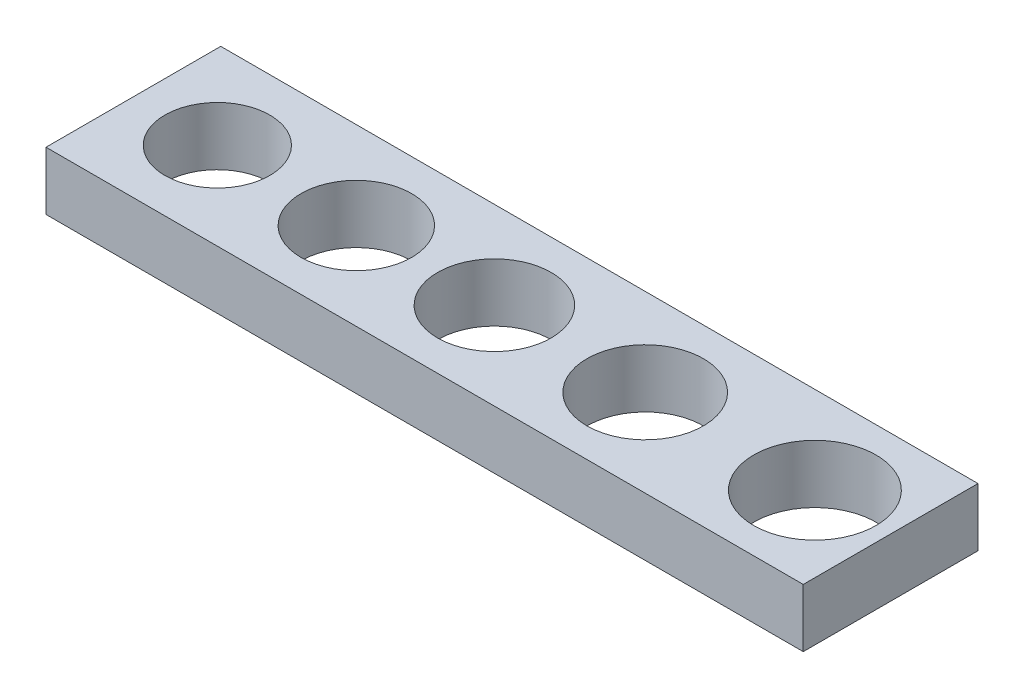
from build123d import *

# Parameters (mm, degrees)
SKETCH1_W           = 65
SKETCH1_H           = 15
BOSS_EXTRUDE1_DEPTH = 5
SKETCH2_R           = 4.75
SKETCH2_R_2         = 5
SKETCH2_R_3         = 5.25
SKETCH2_R_4         = 4.5
SKETCH2_R_5         = 4.875
CUT_EXTRUDE1_DEPTH  = 5


with BuildPart() as part:
    # Sketch1 → Boss-Extrude1 (new body)
    with BuildSketch(Plane(origin=(0, 0, 0), x_dir=(1, 0, 0), z_dir=(0, 1, 0))):
        Rectangle(SKETCH1_W, SKETCH1_H)
    extrude(amount=BOSS_EXTRUDE1_DEPTH)

    # Sketch2 → Cut-Extrude1 (cut)
    with BuildSketch(Plane(origin=(0, 5, 0), x_dir=(1, 0, 0), z_dir=(0, 1, 0))):
        with Locations(Location((-13.362411416, 0, 0), (0, 0, 270))):
            Circle(SKETCH2_R)
        with Locations(Location((11.433777192, 0, 0), (0, 0, 270))):
            Circle(SKETCH2_R_2)
        with Locations(Location((25.998722896, 0, 0), (0, 0, 270))):
            Circle(SKETCH2_R_3)
        with Locations(Location((-25.291630681, 0, 0), (0, 0, 270))):
            Circle(SKETCH2_R_4)
        with Locations(Location((-1.511798245, 0, 0), (0, 0, 270))):
            Circle(SKETCH2_R_5)
    extrude(amount=-CUT_EXTRUDE1_DEPTH, mode=Mode.SUBTRACT)


solid = part.part
